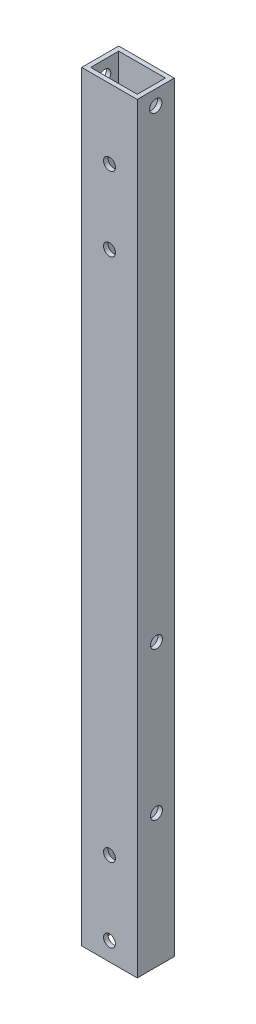
from build123d import *

# Parameters (mm, degrees)
SKETCH_1_W          = 15
SKETCH_1_H          = 10
SKETCH_1_W_2        = 12.6
SKETCH_1_H_2        = 7.6
EXTRUDE_1_DEPTH     = 110
SKETCH_2_R          = 1.6
CUT_EXTRUDE_1_DEPTH = 100
SKETCH_3_R          = 1.6
CUT_EXTRUDE_2_DEPTH = 15
SKETCH_5_W          = 15
SKETCH_5_H          = 10
CUT_EXTRUDE_4_DEPTH = 14.5
SKETCH_6_R          = 1.6
CUT_EXTRUDE_5_DEPTH = 15
CUT_EXTRUDE_6_DEPTH = 15


with BuildPart() as part:
    # ｽｹｯﾁ1 → ﾎﾞｽ - 押し出し1 (new, symmetric)
    with BuildSketch(Plane(origin=(0, 0, 0), x_dir=(1, 0, 0), z_dir=(0, 1, 0))):
        Rectangle(SKETCH_1_W, SKETCH_1_H)
        Rectangle(SKETCH_1_W_2, SKETCH_1_H_2, mode=Mode.SUBTRACT)
    extrude(amount=EXTRUDE_1_DEPTH, both=True)

    # ｽｹｯﾁ2 → ｶｯﾄ - 押し出し1 (cut)
    with BuildSketch(Plane(origin=(0, 0, -5), x_dir=(-1, 0, 0), z_dir=(0, 0, -1))):
        with Locations((0, -85)):
            Circle(SKETCH_2_R)
        with Locations((0, -105)):
            Circle(SKETCH_2_R)
    extrude(amount=-CUT_EXTRUDE_1_DEPTH, mode=Mode.SUBTRACT)

    # ｽｹｯﾁ3 → ｶｯﾄ - 押し出し2 (cut)
    with BuildSketch(Plane.ZY.offset(7.5)):
        with Locations((-0.2, -74)):
            Circle(SKETCH_3_R)
        with Locations((-0.2, -34)):
            Circle(SKETCH_3_R)
    extrude(amount=-CUT_EXTRUDE_2_DEPTH, mode=Mode.SUBTRACT)

    # ｽｹｯﾁ5 → ｶｯﾄ - 押し出し4 (cut)
    with BuildSketch(Plane(origin=(0, 110, 0), x_dir=(1, 0, 0), z_dir=(0, 1, 0))):
        Rectangle(SKETCH_5_W, SKETCH_5_H)
    extrude(amount=-CUT_EXTRUDE_4_DEPTH, mode=Mode.SUBTRACT)

    # ｽｹｯﾁ6 → ｶｯﾄ - 押し出し5 (cut)
    with BuildSketch(Plane(origin=(0, 0, -5), x_dir=(-1, 0, 0), z_dir=(0, 0, -1))):
        with Locations((0, 56.66)):
            Circle(SKETCH_6_R)
        with Locations((0, 76.66)):
            Circle(SKETCH_6_R)
    extrude(amount=-CUT_EXTRUDE_5_DEPTH, mode=Mode.SUBTRACT)

    # ｽｹｯﾁ7 → ｶｯﾄ - 押し出し6 (cut)
    with BuildSketch(Plane.ZY.offset(7.5)):
        with BuildLine():
            ThreePointArc((0, 93.15), (-1.65, 91.5), (0, 89.85))
            ThreePointArc((0, 89.85), (1.65, 91.5), (0, 93.15))
        make_face()
    extrude(amount=-CUT_EXTRUDE_6_DEPTH, mode=Mode.SUBTRACT)


solid = part.part
